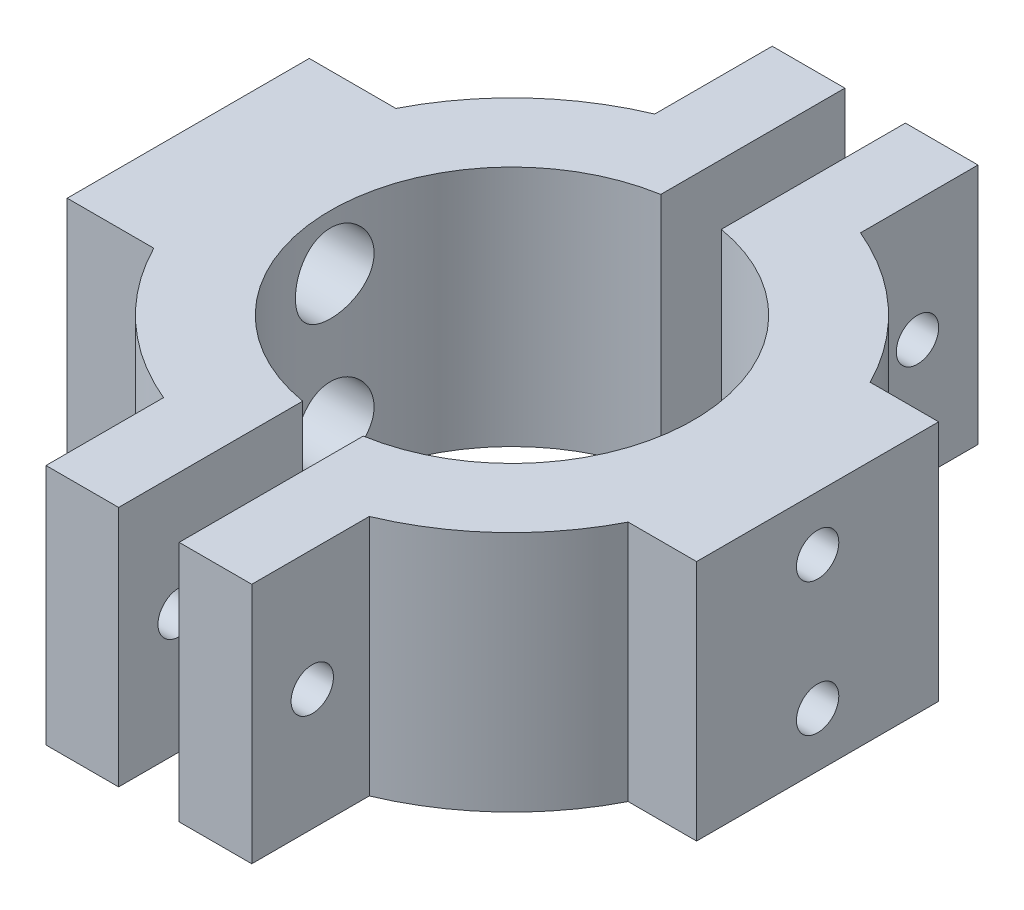
from build123d import *

# Parameters (mm, degrees)
EXTRUDE_1_DEPTH     = 10
EXTRUDE_1_2_DEPTH   = 10
SKETCH_3_R          = 1.75
CUT_EXTRUDE_1_DEPTH = 100
SKETCH_4_R          = 3.25
CUT_EXTRUDE_2_DEPTH = 20
SKETCH_5_R          = 1.75
CUT_EXTRUDE_3_DEPTH = 40
CUT_EXTRUDE_4_DEPTH = 1


with BuildPart() as part:
    # 草图1 → 凸台-拉伸1 (new, symmetric)
    with BuildSketch(Plane(origin=(0, 0, 0), x_dir=(1, 0, 0), z_dir=(0, 1, 0))):
        with BuildLine():
            Line((-26.75, 10), (-19.595917942, 10))
            ThreePointArc((-19.595917942, 10), (-14.960766418, 16.129955616), (-8.5, 20.291623888))
            Line((-8.5, 20.291623888), (-8.5, 30))
            Line((-8.5, 30), (-2.5, 30))
            Line((-2.5, 30), (-2.5, 14.790199458))
            ThreePointArc((-2.5, 14.790199458), (-15, 0), (-2.5, -14.790199458))
            Line((-2.5, -14.790199458), (-2.5, -30))
            Line((-2.5, -30), (-8.5, -30))
            Line((-8.5, -30), (-8.5, -20.291623888))
            ThreePointArc((-8.5, -20.291623888), (-14.960766418, -16.129955616), (-19.595917942, -10))
            Line((-19.595917942, -10), (-26.75, -10))
            Line((-26.75, -10), (-26.75, 10))
        make_face()
    extrude(amount=EXTRUDE_1_DEPTH, both=True)


with BuildPart() as body_2:
    # 草图1 → Extrude 1 2 (new, symmetric)
    with BuildSketch(Plane(origin=(0, 0, 0), x_dir=(1, 0, 0), z_dir=(0, 1, 0))):
        with BuildLine():
            Line((2.5, 30), (2.5, 14.790199458))
            ThreePointArc((2.5, 14.790199458), (15, 0), (2.5, -14.790199458))
            Line((2.5, -14.790199458), (2.5, -30))
            Line((2.5, -30), (8.5, -30))
            Line((8.5, -30), (8.5, -20.291623888))
            ThreePointArc((8.5, -20.291623888), (14.960766418, -16.129955616), (19.595917942, -10))
            Line((19.595917942, -10), (25.25, -10))
            Line((25.25, -10), (25.25, 10))
            Line((25.25, 10), (19.595917942, 10))
            ThreePointArc((19.595917942, 10), (14.960766418, 16.129955616), (8.5, 20.291623888))
            Line((8.5, 20.291623888), (8.5, 30))
            Line((8.5, 30), (2.5, 30))
        make_face()
    extrude(amount=EXTRUDE_1_2_DEPTH, both=True)


with BuildPart() as cut_extrude_1_tool:
    # 草图3 → 切除-拉伸1 (new body)
    with BuildSketch(Plane(origin=(25.25, 0, 0), x_dir=(0, 0, -1), z_dir=(1, 0, 0))):
        with Locations((0, 5.5)):
            Circle(SKETCH_3_R)
        with Locations((0, -5.5)):
            Circle(SKETCH_3_R)
    extrude(amount=-CUT_EXTRUDE_1_DEPTH)


with BuildPart() as part_1:
    add(part.part)

    # 切除-拉伸1: cut by cut_extrude_1_tool
    add(cut_extrude_1_tool.part, mode=Mode.SUBTRACT)


with BuildPart() as body_2_1:
    add(body_2.part)

    # 切除-拉伸1: cut by cut_extrude_1_tool
    add(cut_extrude_1_tool.part, mode=Mode.SUBTRACT)


with BuildPart() as cut_extrude_2_tool:
    # 草图4 → 切除-拉伸2 (new, symmetric)
    with BuildSketch(Plane(origin=(0, 0, 0), x_dir=(0, 0, -1), z_dir=(1, 0, 0))):
        with Locations((0, 5.5)):
            Circle(SKETCH_4_R)
        with Locations((0, -5.5)):
            Circle(SKETCH_4_R)
    extrude(amount=CUT_EXTRUDE_2_DEPTH, both=True)


with BuildPart() as part_2:
    add(part_1.part)

    # 切除-拉伸2: cut by cut_extrude_2_tool
    add(cut_extrude_2_tool.part, mode=Mode.SUBTRACT)


with BuildPart() as body_2_2:
    add(body_2_1.part)

    # 切除-拉伸2: cut by cut_extrude_2_tool
    add(cut_extrude_2_tool.part, mode=Mode.SUBTRACT)


with BuildPart() as cut_extrude_3_tool:
    # 草图5 → 切除-拉伸3 (new body)
    with BuildSketch(Plane.ZY.offset(8.5)):
        with Locations((-25, 0)):
            Circle(SKETCH_5_R)
        with Locations((25, 0)):
            Circle(SKETCH_5_R)
    extrude(amount=-CUT_EXTRUDE_3_DEPTH)


with BuildPart() as part_3:
    add(part_2.part)

    # 切除-拉伸3: cut by cut_extrude_3_tool
    add(cut_extrude_3_tool.part, mode=Mode.SUBTRACT)

    # 草图6 → 切除-拉伸4 (cut)
    with BuildSketch(Plane.ZY.offset(26.75)):
        with BuildLine():
            Line((-5, 1.5), (5, 1.5))
            ThreePointArc((5, 1.5), (6.5, 0), (5, -1.5))
            Line((5, -1.5), (-5, -1.5))
            ThreePointArc((-5, -1.5), (-6.5, 0), (-5, 1.5))
        make_face()
    extrude(amount=-CUT_EXTRUDE_4_DEPTH, mode=Mode.SUBTRACT)


with BuildPart() as body_2_3:
    add(body_2_2.part)

    # 切除-拉伸3: cut by cut_extrude_3_tool
    add(cut_extrude_3_tool.part, mode=Mode.SUBTRACT)


solid = Compound([part_3.part, body_2_3.part])
